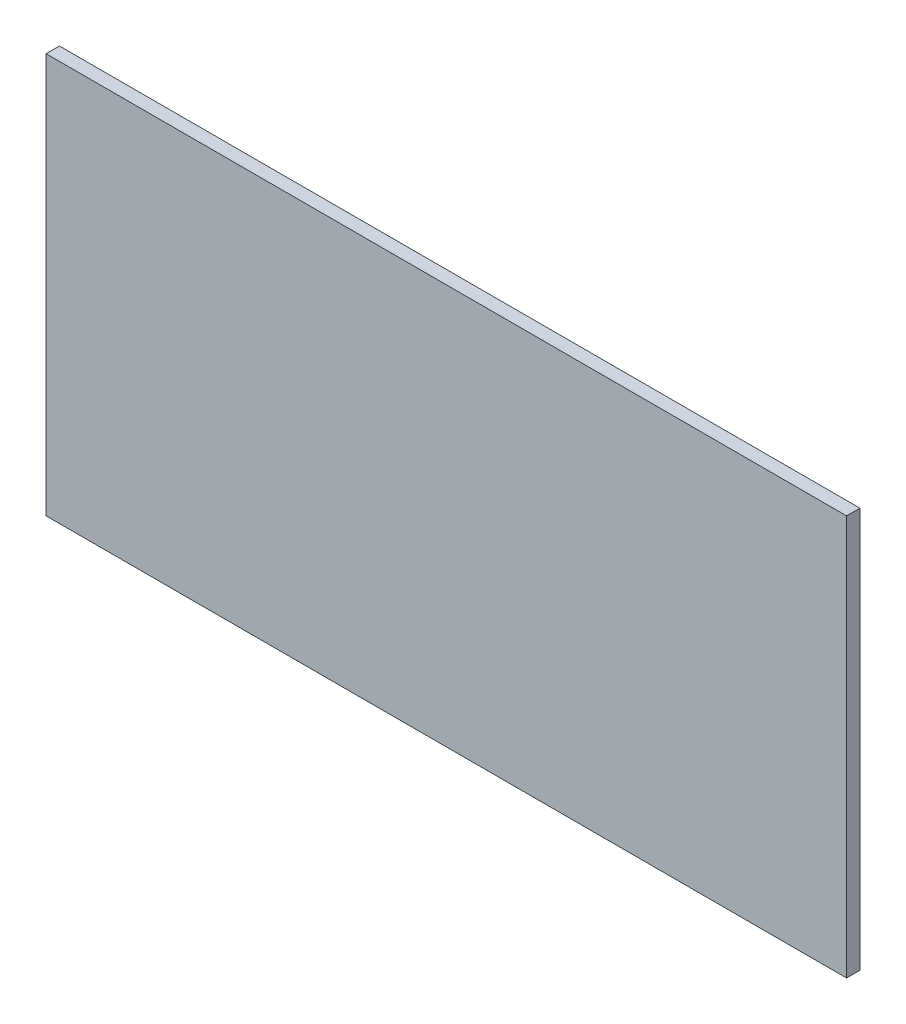
from build123d import *

# Parameters (mm, degrees)
ESQUISSE1_W        = 300
ESQUISSE1_H        = 150
BOSS_EXTRU_1_DEPTH = 5


with BuildPart() as part:
    # Esquisse1 → Boss.-Extru.1 (new body)
    with BuildSketch(Plane.XY):
        Rectangle(ESQUISSE1_W, ESQUISSE1_H)
    extrude(amount=BOSS_EXTRU_1_DEPTH)


solid = part.part
